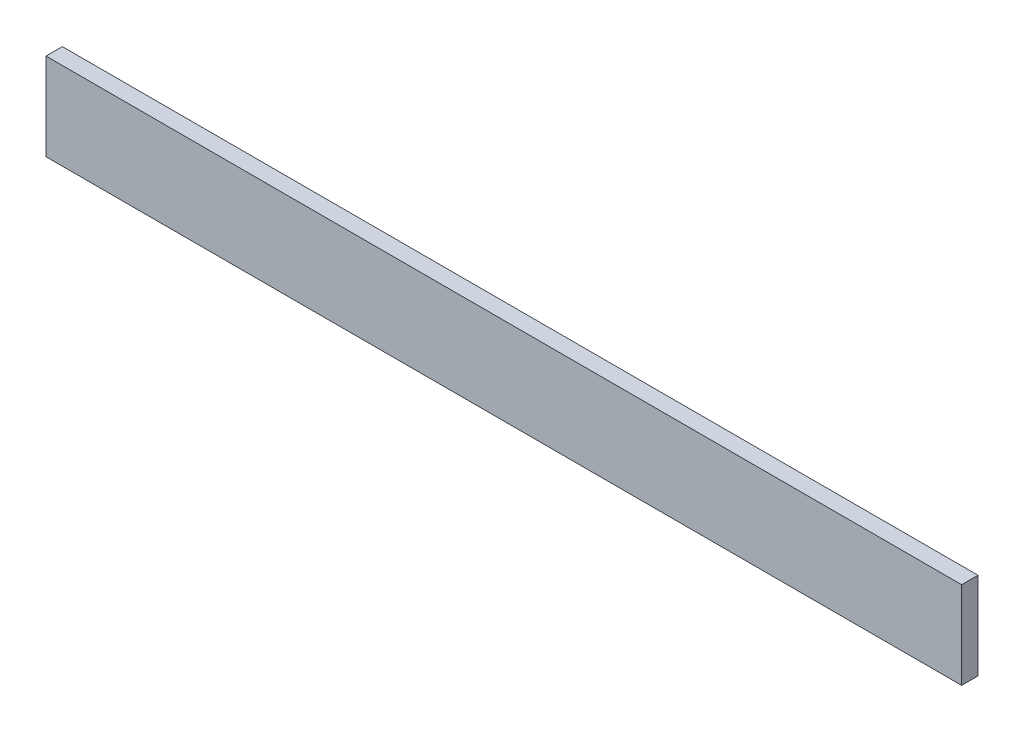
from build123d import *

# Parameters (mm, degrees)
SKETCH1_W           = 1066.8
SKETCH1_H           = 101.6
BOSS_EXTRUDE1_DEPTH = 19.05


with BuildPart() as part:
    # Sketch1 → Boss-Extrude1 (new body)
    with BuildSketch(Plane.XY):
        Rectangle(SKETCH1_W, SKETCH1_H)
    extrude(amount=BOSS_EXTRUDE1_DEPTH)


solid = part.part
